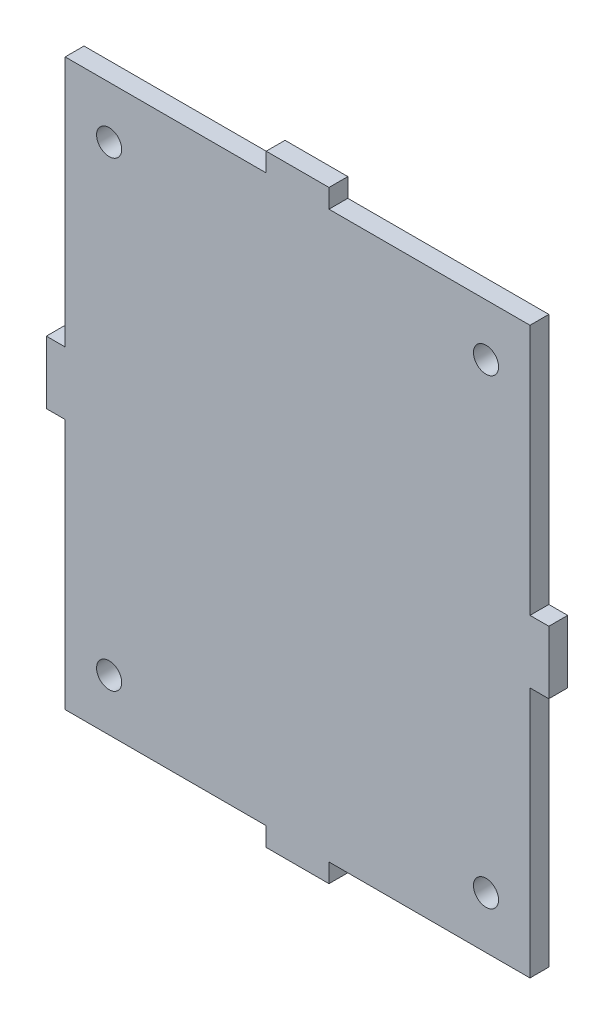
from build123d import *

# Parameters (mm, degrees)
SKETCH1_R           = 2
BOSS_EXTRUDE1_DEPTH = 3
SKETCH2_W           = 3
SKETCH2_H           = 96
CUT_EXTRUDE1_DEPTH  = 10
SKETCH3_W           = 3
SKETCH3_H           = 10
BOSS_EXTRUDE2_DEPTH = 3


with BuildPart() as part:
    # Sketch1 → Boss-Extrude1 (new body)
    with BuildSketch(Plane.XY):
        Polygon((5, 8.25), (40, 8.25), (40, -31.75), (37, -31.75), (37, -41.75), (40, -41.75), (40, -81.75), (5, -81.75), (5, -84.75), (-5, -84.75), (-5, -81.75), (-40, -81.75), (-40, -41.75), (-37, -41.75), (-37, -31.75), (-40, -31.75), (-40, 8.25), (-5, 8.25), (-5, 11.25), (5, 11.25), align=None)
        with Locations((30, 0)):
            Circle(SKETCH1_R, mode=Mode.SUBTRACT)
        with Locations(Location((30, -73.5, 0), (0, 0, 180))):
            Circle(SKETCH1_R, mode=Mode.SUBTRACT)
        with Locations((-30, -73.5)):
            Circle(SKETCH1_R, mode=Mode.SUBTRACT)
        with Locations(Location((-30, 0, 0), (0, 0, 180))):
            Circle(SKETCH1_R, mode=Mode.SUBTRACT)
    extrude(amount=BOSS_EXTRUDE1_DEPTH)

    # Sketch2 → Cut-Extrude1 (cut)
    with BuildSketch(Plane.XY.offset(3)):
        with Locations((38.5, -36.75)):
            Rectangle(SKETCH2_W, SKETCH2_H)
        with Locations((-38.5, -36.75)):
            Rectangle(SKETCH2_W, SKETCH2_H)
    extrude(amount=-CUT_EXTRUDE1_DEPTH, mode=Mode.SUBTRACT)

    # Sketch3 → Boss-Extrude2 (add)
    with BuildSketch(Plane.XY.offset(3)):
        with Locations((38.5, -36.75)):
            Rectangle(SKETCH3_W, SKETCH3_H)
        with Locations((-38.5, -36.75)):
            Rectangle(SKETCH3_W, SKETCH3_H)
    extrude(amount=-BOSS_EXTRUDE2_DEPTH)


solid = part.part
